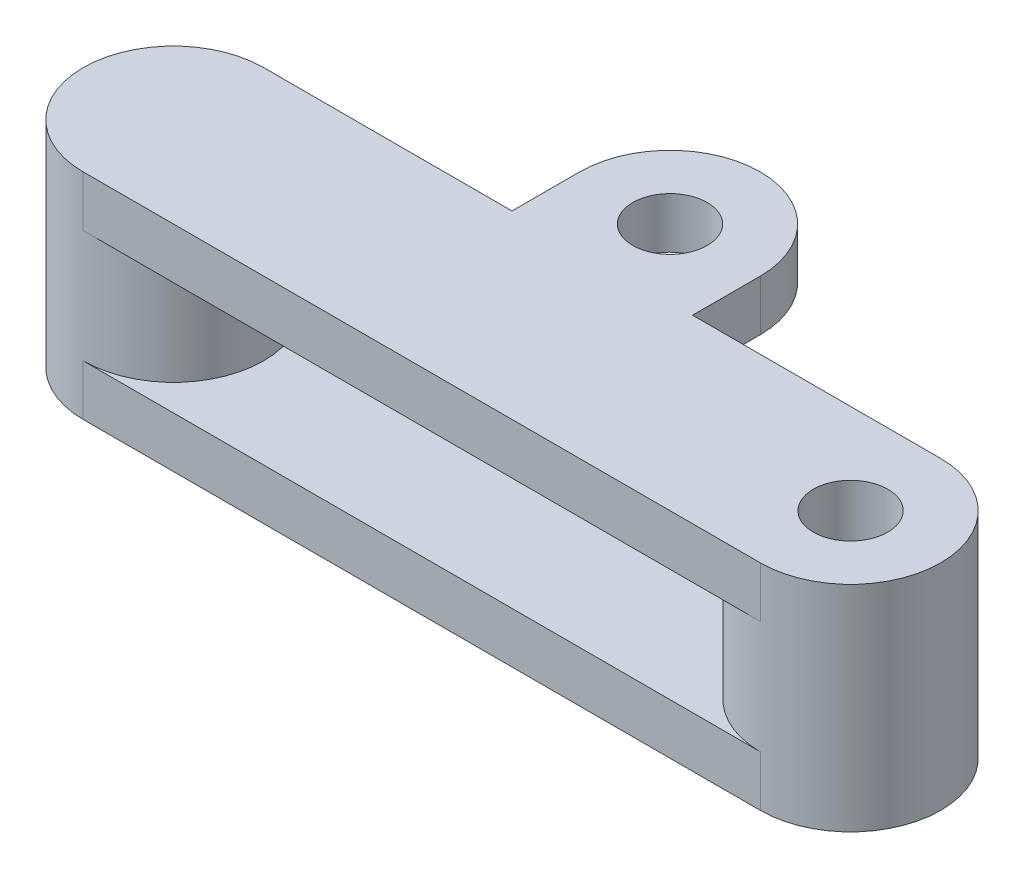
from build123d import *

# Parameters (mm, degrees)
SKETCH1_R               = 1.65
BOSS_EXTRUDE1_DEPTH     = 9.5
CUT_EXTRUDE1_DEPTH      = 2.5
CUT_EXTRUDE1_DEPTH_BACK = 2.5


with BuildPart() as part:
    # Sketch1 → Boss-Extrude1 (new body)
    with BuildSketch(Plane(origin=(0, 0, 0), x_dir=(1, 0, 0), z_dir=(0, 1, 0))):
        with BuildLine():
            Line((0, -4), (-30, -4))
            ThreePointArc((-30, -4), (-34, 0), (-30, 4))
            Line((-30, 4), (-19, 4))
            Line((-19, 4), (-19, 7))
            ThreePointArc((-19, 7), (-15, 11), (-11, 7))
            Line((-11, 7), (-11, 4))
            Line((-11, 4), (0, 4))
            ThreePointArc((0, 4), (4, 0), (0, -4))
        make_face()
        with Locations(Location((0, 0, 0), (0, 0, 270))):
            Circle(SKETCH1_R, mode=Mode.SUBTRACT)
        with Locations(Location((-15, 7, 0), (0, 0, 270))):
            Circle(SKETCH1_R, mode=Mode.SUBTRACT)
    extrude(amount=BOSS_EXTRUDE1_DEPTH)

    # Sketch2 → Cut-Extrude1 (cut, two sides: drawn at the far end of the back side and taken through both)
    with BuildSketch(Plane(origin=(0, 4.75, 0), x_dir=(1, 0, 0), z_dir=(0, 1, 0)).offset(-CUT_EXTRUDE1_DEPTH_BACK)):
        with BuildLine():
            Line((0, 4), (-11, 4))
            Line((-11, 4), (-11, 7))
            ThreePointArc((-11, 7), (-15, 11), (-19, 7))
            Line((-19, 7), (-19, 4))
            Line((-19, 4), (-30, 4))
            ThreePointArc((-30, 4), (-26, 0), (-30, -4))
            Line((-30, -4), (0, -4))
            ThreePointArc((0, -4), (-4, 0), (0, 4))
        make_face()
    extrude(amount=CUT_EXTRUDE1_DEPTH + CUT_EXTRUDE1_DEPTH_BACK, mode=Mode.SUBTRACT)


solid = part.part
